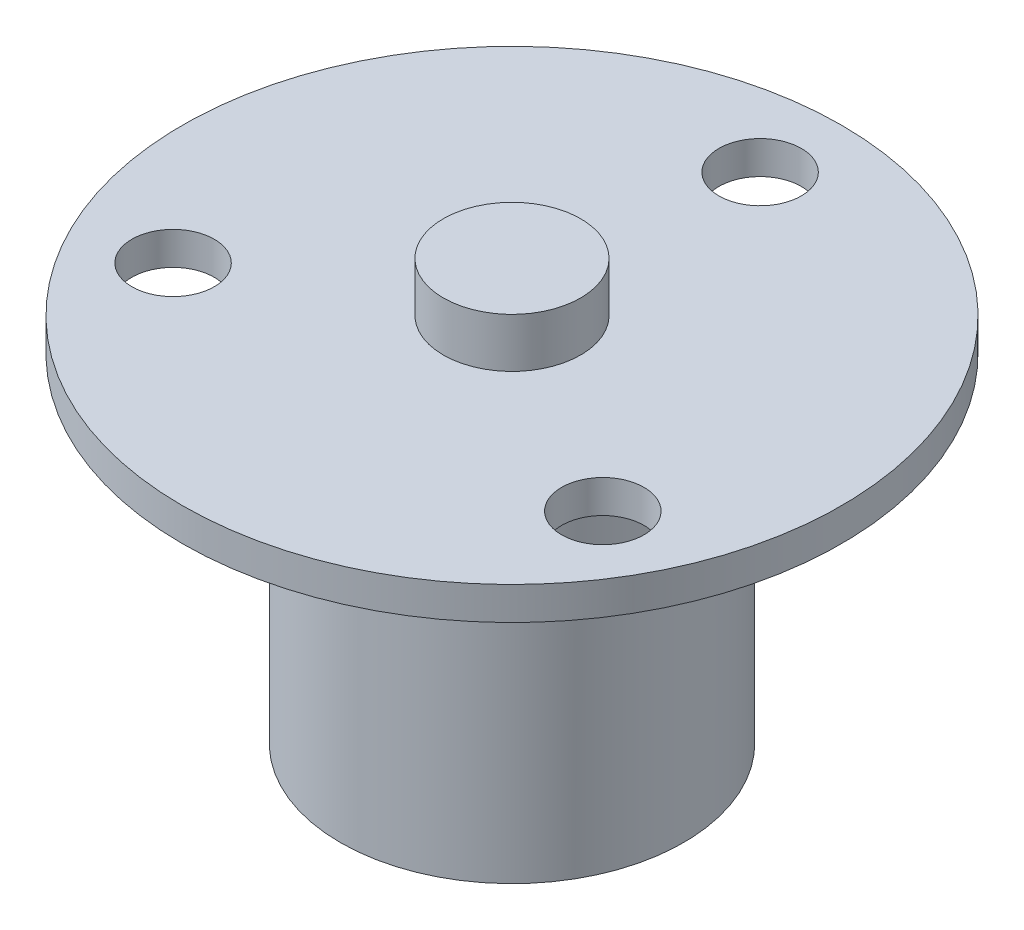
from build123d import *

# Parameters (mm, degrees)
SKETCH1_R           = 12
SKETCH1_R_2         = 2.5
BOSS_EXTRUDE1_DEPTH = 1.2
SKETCH2_R           = 1.5
CUT_EXTRUDE1_DEPTH  = 1.2
SKETCH3_R           = 6.25
BOSS_EXTRUDE2_DEPTH = 12.3
SKETCH4_R           = 2.5
BOSS_EXTRUDE3_DEPTH = 3


with BuildPart() as part:
    # Sketch1 → Boss-Extrude1 (new body)
    with BuildSketch(Plane(origin=(0, 0, 0), x_dir=(1, 0, 0), z_dir=(0, 1, 0))):
        with Locations(Location((0, 0, 0), (0, 0, 270))):
            Circle(SKETCH1_R)
        with Locations(Location((0, 0, 0), (0, 0, 270))):
            Circle(SKETCH1_R_2, mode=Mode.SUBTRACT)
    extrude(amount=BOSS_EXTRUDE1_DEPTH)

    # Sketch2 → Cut-Extrude1 (cut)
    with BuildSketch(Plane(origin=(0, 1.2, 0), x_dir=(1, 0, 0), z_dir=(0, 1, 0))):
        with Locations(Location((0, 9.034469011, 0), (0, 0, 270))):
            Circle(SKETCH2_R)
        with Locations(Location((7.824079673, -4.517234506, 0), (0, 0, 270))):
            Circle(SKETCH2_R)
        with Locations(Location((-7.824079673, -4.517234506, 0), (0, 0, 270))):
            Circle(SKETCH2_R)
    extrude(amount=-CUT_EXTRUDE1_DEPTH, mode=Mode.SUBTRACT)

    # Sketch3 → Boss-Extrude2 (add)
    with BuildSketch(Plane(origin=(0, 0, 0), x_dir=(-1, 0, 0), z_dir=(0, -1, 0))):
        with Locations(Location((0, 0, 0), (0, 0, 270))):
            Circle(SKETCH3_R)
    extrude(amount=BOSS_EXTRUDE2_DEPTH)

    # Sketch4 → Boss-Extrude3 (add)
    with BuildSketch(Plane(origin=(0, 0, 0), x_dir=(1, 0, 0), z_dir=(0, 1, 0))):
        with Locations(Location((0, 0, 0), (0, 0, 270))):
            Circle(SKETCH4_R)
    extrude(amount=BOSS_EXTRUDE3_DEPTH)


solid = part.part
